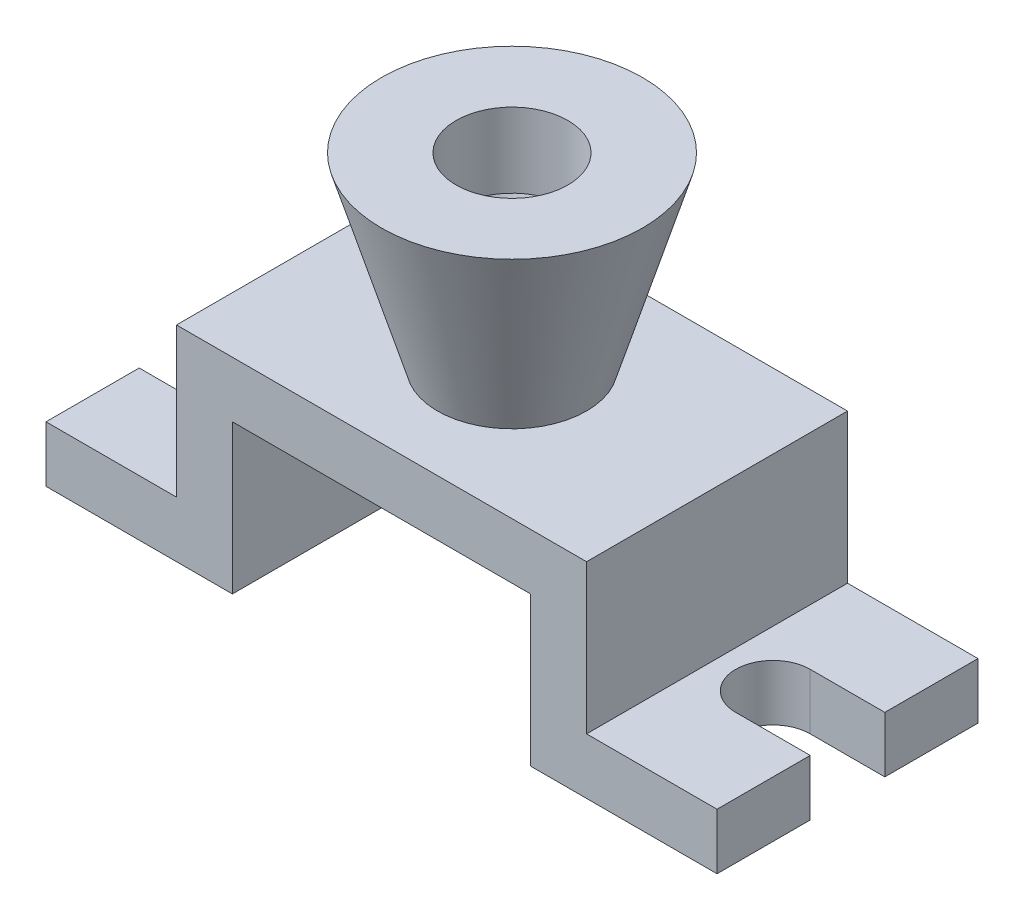
from build123d import *

# Parameters (mm, degrees)
BOSS_EXTRUDE1_DEPTH = 35
SKETCH4_R           = 8
CUT_EXTRUDE1_DEPTH  = 112.130553854


with BuildPart() as part:
    # Sketch2 → Boss-Extrude1 (new, symmetric)
    with BuildSketch(Plane.XY):
        Polygon((-90, 0), (-40, 0), (-40, 40), (40, 40), (40, 0), (90, 0), (90, 15), (55, 15), (55, 55), (-55, 55), (-55, 15), (-90, 15), align=None)
    extrude(amount=BOSS_EXTRUDE1_DEPTH, both=True)

    # Sketch4 → Cut-Extrude1 (cut, through all)
    with BuildSketch(Plane(origin=(0, 55, 0), x_dir=(1, 0, 0), z_dir=(0, 1, 0))):
        with Locations(Location((0, 0, 0), (0, 0, 180))):
            Circle(SKETCH4_R)
        with BuildLine():
            Line((-70, 10), (-90, 10))
            Line((-90, 10), (-90, -10))
            Line((-90, -10), (-70, -10))
            ThreePointArc((-70, -10), (-60, 0), (-70, 10))
        make_face()
        with BuildLine():
            Line((90, -10), (90, 10))
            Line((90, 10), (70, 10))
            ThreePointArc((70, 10), (60, 0), (70, -10))
            Line((70, -10), (90, -10))
        make_face()
    extrude(amount=-CUT_EXTRUDE1_DEPTH, mode=Mode.SUBTRACT)

    # Sketch5 → Revolve1 (revolve)
    with BuildSketch(Plane.XY, mode=Mode.PRIVATE) as revolve1_sk:
        Polygon((-35, 105), (-20, 55), (-8, 55), (-8, 70), (-15, 85), (-15, 105), align=None)
    revolve(revolve1_sk.sketch.rotate(Axis((0, 55, 0), (0, 1, 0)), 180), axis=Axis((0, 55, 0), (0, 1, 0)))


solid = part.part
